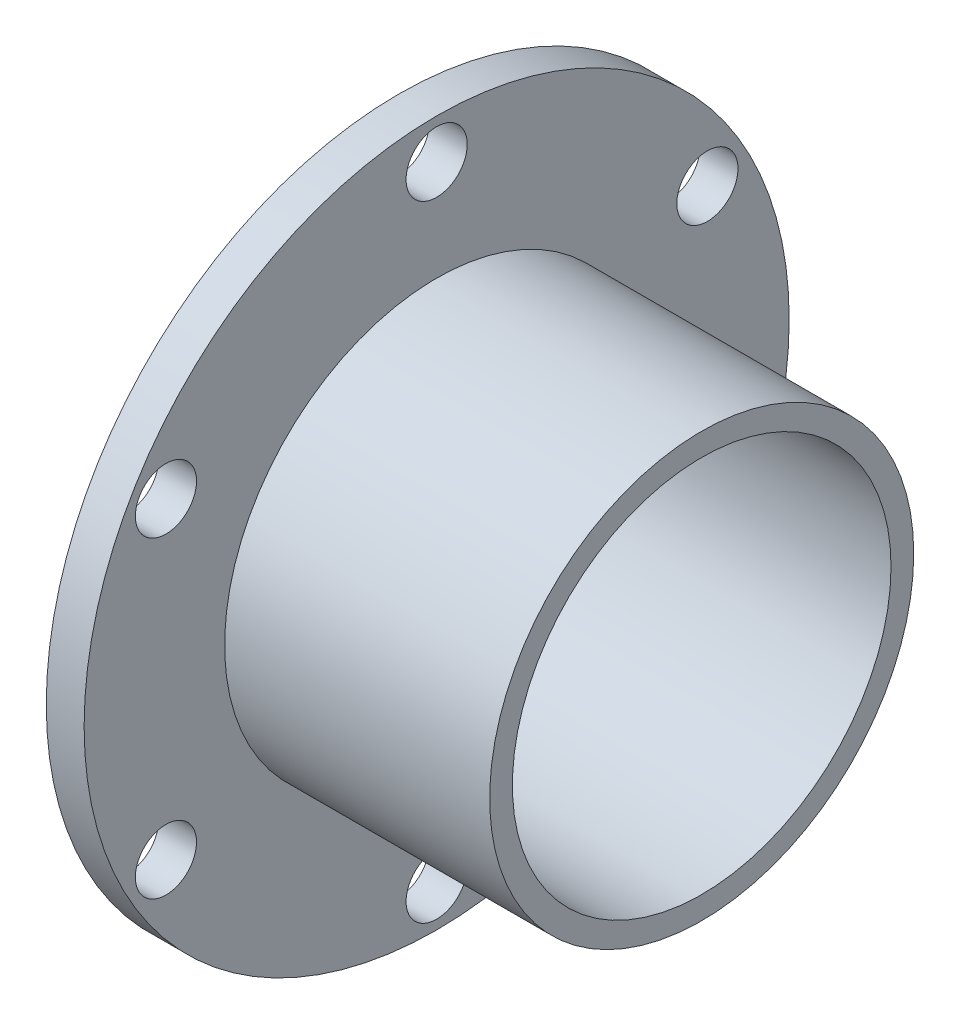
from build123d import *

# Parameters (mm, degrees)
SKETCH1_R           = 23.276074499
SKETCH1_R_2         = 2.0193
BOSS_EXTRUDE1_DEPTH = 2.5
SKETCH4_R           = 14
CUT_EXTRUDE2_DEPTH  = 30.8125
SKETCH5_R           = 14
SKETCH5_R_2         = 12.5
BOSS_EXTRUDE2_DEPTH = 20


with BuildPart() as part:
    # Sketch1 → Boss-Extrude1 (new body)
    with BuildSketch(Plane(origin=(0, 0, 0), x_dir=(0, 0, -1), z_dir=(1, 0, 0))):
        Circle(SKETCH1_R)
        with Locations((0, 20.64)):
            Circle(SKETCH1_R_2, mode=Mode.SUBTRACT)
        with Locations((17.874764334, 10.32)):
            Circle(SKETCH1_R_2, mode=Mode.SUBTRACT)
        with Locations((17.874764334, -10.32)):
            Circle(SKETCH1_R_2, mode=Mode.SUBTRACT)
        with Locations((0, -20.64)):
            Circle(SKETCH1_R_2, mode=Mode.SUBTRACT)
        with Locations((-17.874764334, -10.32)):
            Circle(SKETCH1_R_2, mode=Mode.SUBTRACT)
        with Locations((-17.874764334, 10.32)):
            Circle(SKETCH1_R_2, mode=Mode.SUBTRACT)
    extrude(amount=BOSS_EXTRUDE1_DEPTH)

    # Sketch4 → Cut-Extrude2 (cut)
    with BuildSketch(Plane.ZY):
        Circle(SKETCH4_R)
    extrude(amount=-CUT_EXTRUDE2_DEPTH, mode=Mode.SUBTRACT)

    # Sketch5 → Boss-Extrude2 (add)
    with BuildSketch(Plane(origin=(0, 0, 0), x_dir=(0, 0, -1), z_dir=(1, 0, 0))):
        Circle(SKETCH5_R)
        Circle(SKETCH5_R_2, mode=Mode.SUBTRACT)
    extrude(amount=BOSS_EXTRUDE2_DEPTH)


solid = part.part
